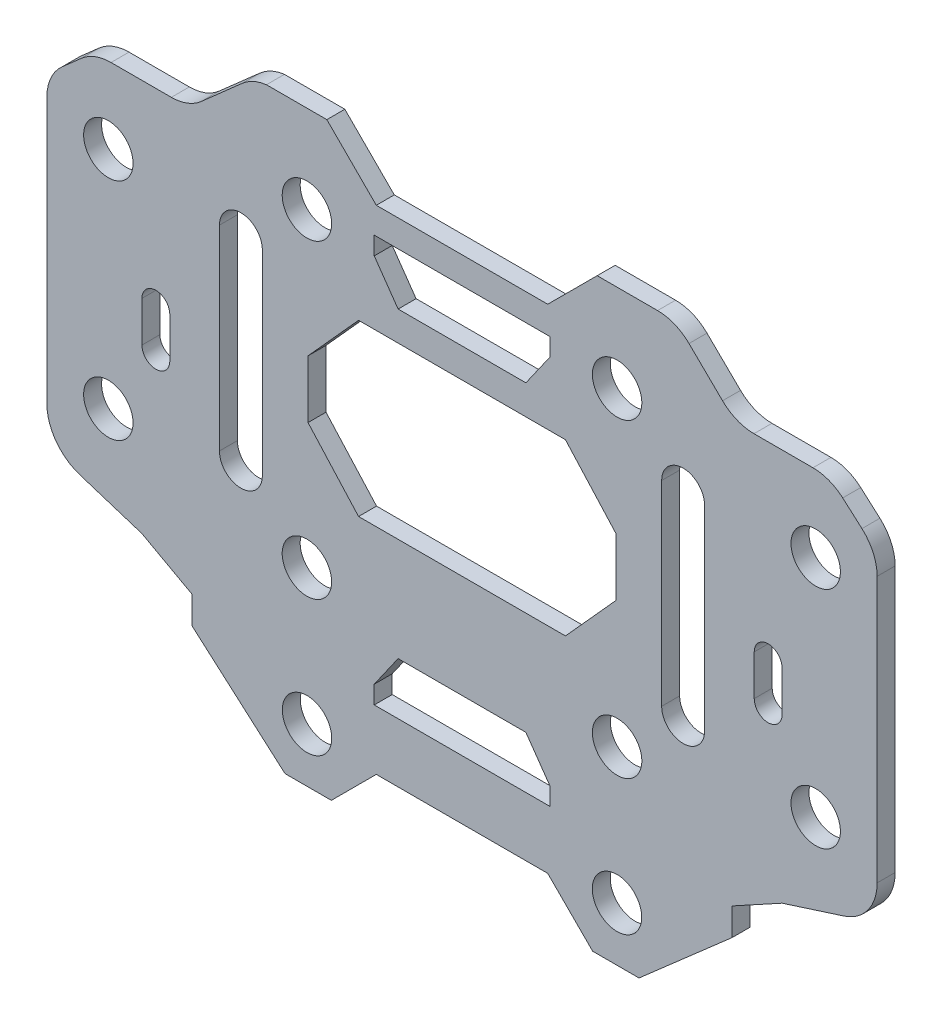
from build123d import *

# Parameters (mm, degrees)
SKETCH_1_R      = 2.75
EXTRUDE_1_DEPTH = 2


with BuildPart() as part:
    # 草图1 → 凸台-拉伸1 (new body)
    with BuildSketch(Plane.XY):
        with BuildLine():
            Line((-24.447800114, 142.867788384), (-29.015821613, 138.834288737))
            ThreePointArc((-29.015821613, 138.834288737), (-30.556091587, 137.905760103), (-32.325263946, 137.582300402))
            Line((-32.325263946, 137.582300402), (-39.033457742, 137.582300402))
            ThreePointArc((-39.033457742, 137.582300402), (-40.802630101, 137.2588407), (-42.342900075, 136.330312067))
            Line((-42.342900075, 136.330312067), (-44.480254451, 134.443057788))
            ThreePointArc((-44.480254451, 134.443057788), (-45.728619247, 132.750865708), (-46.170812117, 130.695046123))
            Line((-46.170812117, 130.695046123), (-46.170812117, 101.166813467))
            ThreePointArc((-46.170812117, 101.166813467), (-45.154526002, 98.050429516), (-42.496431366, 96.132300402))
            Line((-42.496431366, 96.132300402), (-35.6, 93.92431119))
            Line((-35.6, 93.92431119), (-30.05244945, 90.888042458))
            Line((-30.05244945, 90.888042458), (-30.05244945, 87.84217512))
            Line((-30.05244945, 87.84217512), (-19.688242157, 78.763336754))
            Line((-19.688242157, 78.763336754), (-14.532154357, 78.763336754))
            Line((-14.532154357, 78.763336754), (-9.532154357, 83.763336754))
            Line((-9.532154357, 83.763336754), (9.532154357, 83.763336754))
            Line((9.532154357, 83.763336754), (14.532154357, 78.763336754))
            Line((14.532154357, 78.763336754), (19.688242157, 78.763336754))
            Line((19.688242157, 78.763336754), (30.05244945, 87.84217512))
            Line((30.05244945, 87.84217512), (30.05244945, 90.888042458))
            Line((30.05244945, 90.888042458), (35.6, 93.92431119))
            Line((35.6, 93.92431119), (42.496431366, 96.132300402))
            ThreePointArc((42.496431366, 96.132300402), (45.154526002, 98.050429516), (46.170812117, 101.166813467))
            Line((46.170812117, 101.166813467), (46.170812117, 130.695046123))
            ThreePointArc((46.170812117, 130.695046123), (45.728619247, 132.750865708), (44.480254451, 134.443057788))
            Line((44.480254451, 134.443057788), (42.342900075, 136.330312067))
            ThreePointArc((42.342900075, 136.330312067), (40.802630101, 137.2588407), (39.033457742, 137.582300402))
            Line((39.033457742, 137.582300402), (32.472417217, 137.582300402))
            ThreePointArc((32.472417217, 137.582300402), (30.584617738, 137.952374579), (28.976268595, 139.007815151))
            Line((28.976268595, 139.007815151), (25.245537252, 142.656785653))
            ThreePointArc((25.245537252, 142.656785653), (23.637188108, 143.712226225), (21.74938863, 144.082300402))
            Line((21.74938863, 144.082300402), (15.032154357, 144.082300402))
            Line((15.032154357, 144.082300402), (9.532154357, 138.582300402))
            Line((9.532154357, 138.582300402), (-9.532154357, 138.582300402))
            Line((-9.532154357, 138.582300402), (-15.032154357, 144.082300402))
            Line((-15.032154357, 144.082300402), (-21.74938863, 144.082300402))
            ThreePointArc((-21.74938863, 144.082300402), (-23.190499918, 143.679240794), (-24.447800114, 142.867788384))
        make_face()
        with Locations((39.335406059, 129.082300402)):
            Circle(SKETCH_1_R, mode=Mode.SUBTRACT)
        with Locations((39.335406059, 104.082300402)):
            Circle(SKETCH_1_R, mode=Mode.SUBTRACT)
        with Locations((17.23796389, 84.763336754)):
            Circle(SKETCH_1_R, mode=Mode.SUBTRACT)
        with Locations(Location((-17.23796389, 84.763336754, 0), (0, 0, 180))):
            Circle(SKETCH_1_R, mode=Mode.SUBTRACT)
        with Locations(Location((-39.335406059, 104.082300402, 0), (0, 0, 180))):
            Circle(SKETCH_1_R, mode=Mode.SUBTRACT)
        with Locations(Location((-39.335406059, 129.082300402, 0), (0, 0, 180))):
            Circle(SKETCH_1_R, mode=Mode.SUBTRACT)
        with Locations((17.25, 134.317818161)):
            Circle(SKETCH_1_R, mode=Mode.SUBTRACT)
        with Locations(Location((17.25, 99.817818161, 0), (0, 0, 180))):
            Circle(SKETCH_1_R, mode=Mode.SUBTRACT)
        with Locations((-17.25, 99.817818161)):
            Circle(SKETCH_1_R, mode=Mode.SUBTRACT)
        with Locations(Location((-17.25, 134.317818161, 0), (0, 0, 180))):
            Circle(SKETCH_1_R, mode=Mode.SUBTRACT)
        Polygon((7.105388598, 96.132300402), (-7.105388598, 96.132300402), (-9.761471208, 92.339021317), (-9.761471208, 90.339021317), (9.761471208, 90.339021317), (9.761471208, 92.339021317), align=None, mode=Mode.SUBTRACT)
        with BuildLine():
            Line((-35.6, 116.582300402), (-35.6, 112.082300402))
            ThreePointArc((-35.6, 112.082300402), (-34.05, 110.532300402), (-32.5, 112.082300402))
            Line((-32.5, 112.082300402), (-32.5, 116.582300402))
            ThreePointArc((-32.5, 116.582300402), (-34.05, 118.132300402), (-35.6, 116.582300402))
        make_face(mode=Mode.SUBTRACT)
        with BuildLine():
            Line((35.6, 116.582300402), (35.6, 112.082300402))
            ThreePointArc((35.6, 112.082300402), (34.05, 110.532300402), (32.5, 112.082300402))
            Line((32.5, 112.082300402), (32.5, 116.582300402))
            ThreePointArc((32.5, 116.582300402), (34.05, 118.132300402), (35.6, 116.582300402))
        make_face(mode=Mode.SUBTRACT)
        Polygon((-17.12762315, 113.853040841), (-11.506056087, 107.618637195), (11.506056087, 107.618637195), (17.12762315, 113.853040841), (17.12762315, 120.282595482), (11.506056087, 126.516999128), (-11.506056087, 126.516999128), (-17.12762315, 120.282595482), align=None, mode=Mode.SUBTRACT)
        Polygon((-7.105388598, 129.79821171), (7.105388598, 129.79821171), (9.761471208, 133.591490795), (9.761471208, 135.591490795), (-9.761471208, 135.591490795), (-9.761471208, 133.591490795), align=None, mode=Mode.SUBTRACT)
        with BuildLine():
            Line((-22.20520244, 127.943672987), (-22.20520244, 106.191963336))
            ThreePointArc((-22.20520244, 106.191963336), (-24.592663446, 103.80450233), (-26.980124451, 106.191963336))
            Line((-26.980124451, 106.191963336), (-26.980124451, 127.943672987))
            ThreePointArc((-26.980124451, 127.943672987), (-24.592663446, 130.331133992), (-22.20520244, 127.943672987))
        make_face(mode=Mode.SUBTRACT)
        with BuildLine():
            Line((22.20520244, 127.943672987), (22.20520244, 106.191963336))
            ThreePointArc((22.20520244, 106.191963336), (24.592663446, 103.80450233), (26.980124451, 106.191963336))
            Line((26.980124451, 106.191963336), (26.980124451, 127.943672987))
            ThreePointArc((26.980124451, 127.943672987), (24.592663446, 130.331133992), (22.20520244, 127.943672987))
        make_face(mode=Mode.SUBTRACT)
    extrude(amount=EXTRUDE_1_DEPTH)


solid = part.part
